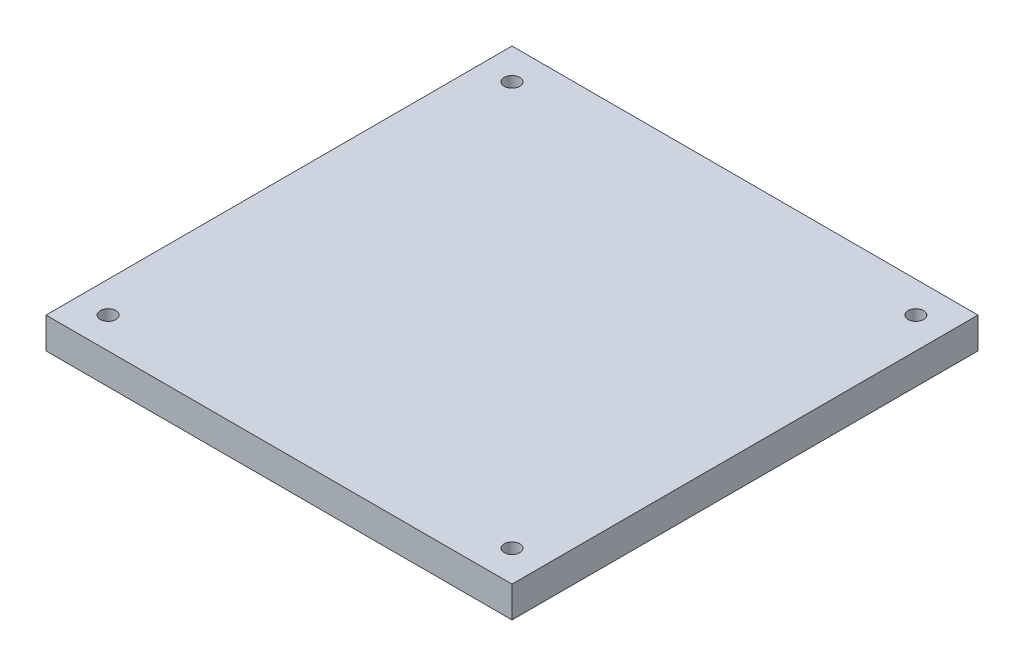
from build123d import *

# Parameters (mm, degrees)
SKETCH1_W           = 150
SKETCH1_H           = 150
BOSS_EXTRUDE1_DEPTH = 10
M6_TAPPED_HOLE1_D   = 5


with BuildPart() as part:
    # Sketch1 → Boss-Extrude1 (new body)
    with BuildSketch(Plane(origin=(0, 0, 0), x_dir=(1, 0, 0), z_dir=(0, 1, 0))):
        Rectangle(SKETCH1_W, SKETCH1_H)
    extrude(amount=BOSS_EXTRUDE1_DEPTH)

    # M6 Tapped Hole1 (through all)
    with Locations(Plane(origin=(65, 0, 65), x_dir=(0, 0, -1), z_dir=(0, -1, 0))):
        with Locations((0, 0), (130, 0), (130, -130), (0, -130)):
            Hole(M6_TAPPED_HOLE1_D / 2)


solid = part.part
